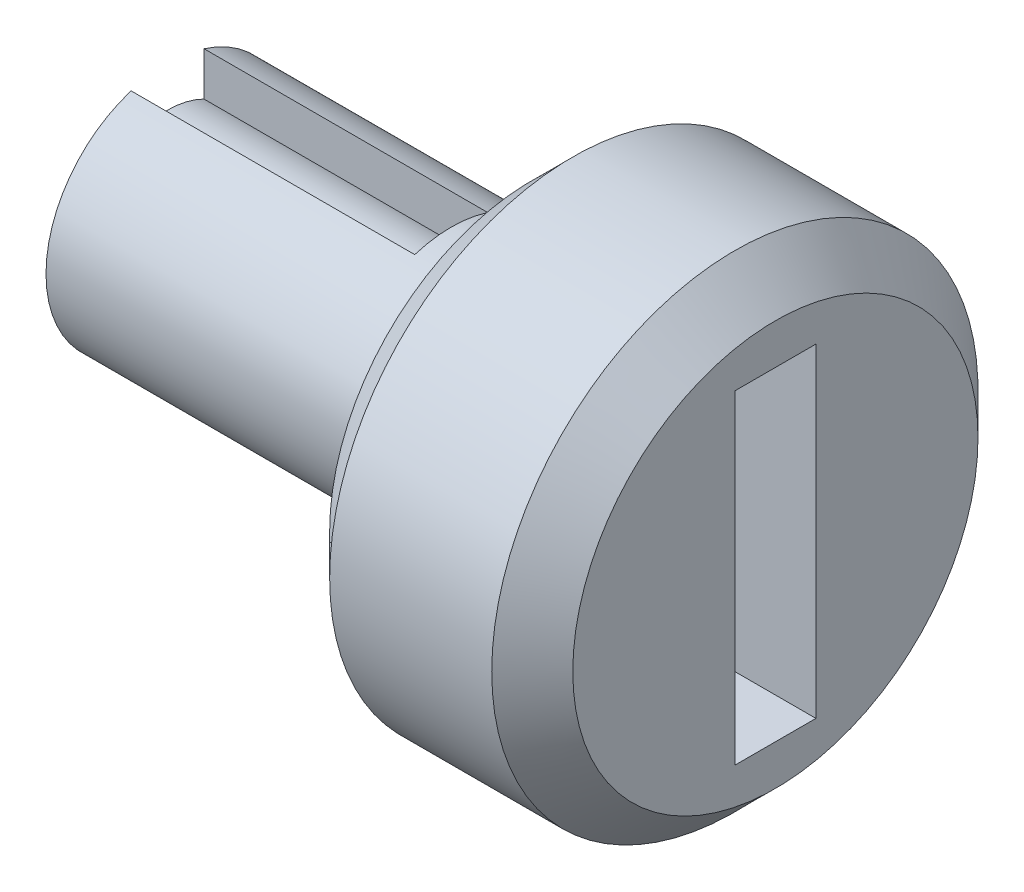
from build123d import *

# Parameters (mm, degrees)
SKETCH3_R          = 1.2
CUT_EXTRUDE1_DEPTH = 9
SKETCH4_W          = 2
SKETCH4_H          = 8
CUT_EXTRUDE2_DEPTH = 4
CHAMFER1_SIZE      = 1
CUT_EXTRUDE3_START = -7
CUT_EXTRUDE3_DEPTH = 7


with BuildPart() as part:
    # Sketch2 → Revolve1 (revolve)
    with BuildSketch(Plane(origin=(0, 0, 0), x_dir=(1, 0, 0), z_dir=(0, 1, 0)), mode=Mode.PRIVATE) as revolve1_sk:
        Polygon((0, 0), (0, 3), (9, 3), (9, 6), (15, 6), (15, 0), align=None)
    revolve(revolve1_sk.sketch.rotate(Axis((0, 0, 0), (1, 0, 0)), 180), axis=Axis((0, 0, 0), (1, 0, 0)))

    # Sketch3 → Cut-Extrude1 (cut)
    with BuildSketch(Plane.ZY):
        Circle(SKETCH3_R)
    extrude(amount=-CUT_EXTRUDE1_DEPTH, mode=Mode.SUBTRACT)

    # Sketch4 → Cut-Extrude2 (cut)
    with BuildSketch(Plane(origin=(15, 0, 0), x_dir=(0, 0, -1), z_dir=(1, 0, 0))):
        Rectangle(SKETCH4_W, SKETCH4_H)
    extrude(amount=-CUT_EXTRUDE2_DEPTH, mode=Mode.SUBTRACT)

    # Chamfer1
    chamfer1_edges = [part.edges().sort_by_distance(p)[0] for p in [
        (15, 0, -6),
        (9, 0, -6),
    ]]
    chamfer(chamfer1_edges, length=CHAMFER1_SIZE)

    # Sketch5 → Cut-Extrude3 (cut)
    with BuildSketch(Plane.ZY.offset(CUT_EXTRUDE3_START)):
        with BuildLine():
            Line((-0.9, 2.861817604), (-0.9, 1.78605711))
            ThreePointArc((-0.9, 1.78605711), (0, 2), (0.9, 1.78605711))
            Line((0.9, 1.78605711), (0.9, 2.861817604))
            ThreePointArc((0.9, 2.861817604), (0, 3), (-0.9, 2.861817604))
        make_face()
        with BuildLine():
            Line((-0.9, -1.78605711), (-0.9, -2.861817604))
            ThreePointArc((-0.9, -2.861817604), (0, -3), (0.9, -2.861817604))
            Line((0.9, -2.861817604), (0.9, -1.78605711))
            ThreePointArc((0.9, -1.78605711), (0, -2), (-0.9, -1.78605711))
        make_face()
    extrude(amount=CUT_EXTRUDE3_DEPTH, mode=Mode.SUBTRACT)


solid = part.part
